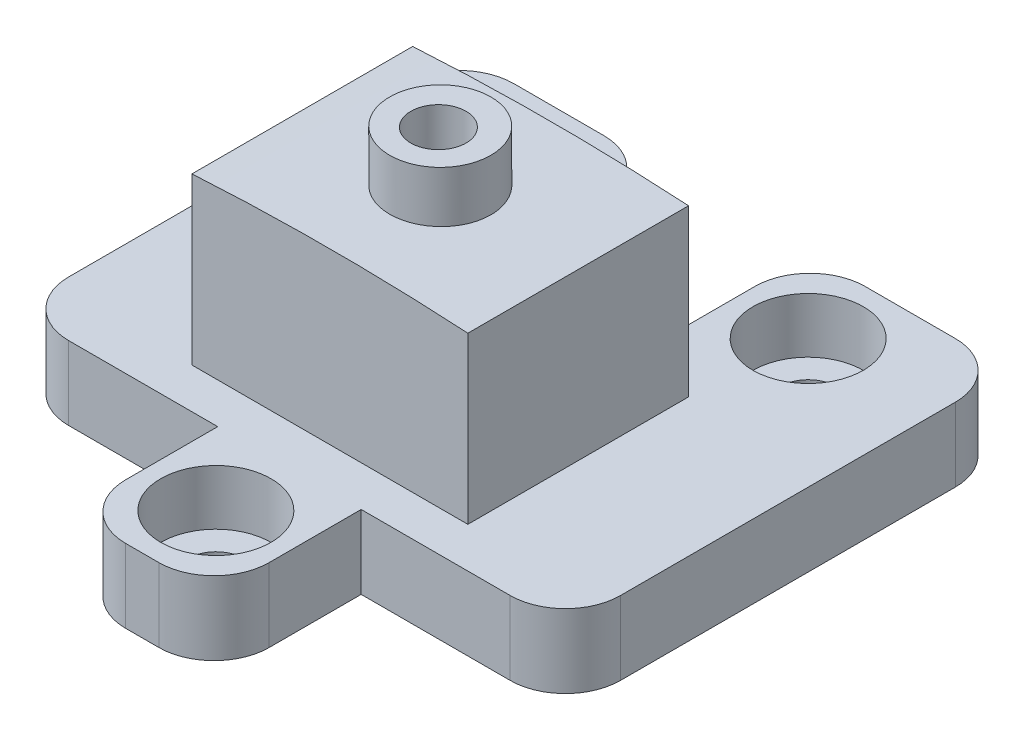
from build123d import *

# Parameters (mm, degrees)
EXTRUDE_1_DEPTH           = 4
SKETCH_2_R                = 1.5
CUT_EXTRUDE_2_DEPTH       = 23.365375025
SKETCH_3_R                = 3
CUT_EXTRUDE_3_DEPTH       = 3
FILLET_1_R                = 3
SKETCH_4_W                = 15
SKETCH_4_H                = 12
EXTRUDE_2_DEPTH           = 10
CUT_EXTRUDE_7_DEPTH       = 31.229786635
SKETCH_9_R                = 2.75
EXTRUDE_3_DEPTH           = 3
SKETCH_10_R               = 1.5
CUT_EXTRUDE_8_DEPTH       = 28.20680062
CUT_EXTRUDE_9_REACH       = 29.207
CUT_EXTRUDE_9_END_RADIUS  = 122
CUT_EXTRUDE_13_REACH      = 29.207
CUT_EXTRUDE_13_END_RADIUS = 119
SKETCH_12_W               = 8
SKETCH_12_H               = 6


with BuildPart() as part:
    # 草图1 → 凸台-拉伸1 (new body)
    with BuildSketch(Plane(origin=(0, 0, 0), x_dir=(1, 0, 0), z_dir=(0, 1, 0))):
        Polygon((-15, 16.1), (-4.1, 16.1), (-4.1, 8.1), (4.1, 8.1), (4.1, 16.1), (15, 16.1), (15, -8.1), (3.9, -8.1), (3.9, -16.1), (-3.9, -16.1), (-3.9, -8.1), (-15, -8.1), align=None)
    extrude(amount=EXTRUDE_1_DEPTH)

    # 草图2 → 切除-拉伸2 (cut, through all)
    with BuildSketch(Plane(origin=(0, 0, 0), x_dir=(1, 0, 0), z_dir=(0, 1, 0))):
        with Locations(Location((-8, 12.1, 0), (0, 0, 270))):
            Circle(SKETCH_2_R)
        with Locations(Location((8, 12.1, 0), (0, 0, 270))):
            Circle(SKETCH_2_R)
        with Locations(Location((0, -12.1, 0), (0, 0, 270))):
            Circle(SKETCH_2_R)
    extrude(amount=CUT_EXTRUDE_2_DEPTH, mode=Mode.SUBTRACT)

    # 草图3 → 切除-拉伸3 (cut)
    with BuildSketch(Plane(origin=(0, 4, 0), x_dir=(1, 0, 0), z_dir=(0, 1, 0))):
        with Locations(Location((-8, 12.1, 0), (0, 0, 270))):
            Circle(SKETCH_3_R)
        with Locations(Location((8, 12.1, 0), (0, 0, 270))):
            Circle(SKETCH_3_R)
        with Locations(Location((0, -12.1, 0), (0, 0, 270))):
            Circle(SKETCH_3_R)
    extrude(amount=-CUT_EXTRUDE_3_DEPTH, mode=Mode.SUBTRACT)

    # 圆角1
    fillet_1_edges = [part.edges().sort_by_distance(p)[0] for p in [
        (-15, 2, -16.1),
        (-4.1, 2, -16.1),
        (4.1, 2, -16.1),
        (15, 2, -16.1),
        (15, 2, 8.1),
        (3.9, 2, 16.1),
        (-3.9, 2, 16.1),
        (-15, 2, 8.1),
    ]]
    fillet(fillet_1_edges, radius=FILLET_1_R)

    # 草图4 → 凸台-拉伸2 (add)
    with BuildSketch(Plane(origin=(0, 4, 0), x_dir=(1, 0, 0), z_dir=(0, 1, 0))):
        with Locations((0, 0.1)):
            Rectangle(SKETCH_4_W, SKETCH_4_H)
    extrude(amount=EXTRUDE_2_DEPTH)

    # 草图8 → 切除-拉伸7 (cut, through all)
    with BuildSketch(Plane(origin=(0, 0, -6.1), x_dir=(-1, 0, 0), z_dir=(0, 0, -1))):
        with BuildLine():
            Line((-7.5, 13), (-7.5, 14))
            Line((-7.5, 14), (7.5, 14))
            Line((7.5, 14), (7.5, 13))
            ThreePointArc((7.5, 13), (0, 13.225202865), (-7.5, 13))
        make_face()
    extrude(amount=-CUT_EXTRUDE_7_DEPTH, mode=Mode.SUBTRACT)

    # 草图9 → 凸台-拉伸3 (add)
    with BuildSketch(Plane(origin=(0, 13, 0), x_dir=(-1, 0, 0), z_dir=(0, -1, 0))):
        with Locations(Location((0, 0.1, 0), (0, 0, 180))):
            Circle(SKETCH_9_R)
    extrude(amount=-EXTRUDE_3_DEPTH)

    # 草图10 → 切除-拉伸8 (cut, through all)
    with BuildSketch(Plane(origin=(0, 16, 0), x_dir=(1, 0, 0), z_dir=(0, 1, 0))):
        with Locations(Location((0, 0, 0), (0, 0, 180))):
            Circle(SKETCH_10_R)
    extrude(amount=-CUT_EXTRUDE_8_DEPTH, mode=Mode.SUBTRACT)

    # 切除-拉伸9: up to this cylinder (the profile starts inside it)
    cut_extrude_9_end = Plane(origin=(0, -111.774797135, 0), z_dir=(0, 0, -1)) * Cylinder(CUT_EXTRUDE_9_END_RADIUS, 303.414, mode=Mode.PRIVATE)
    # 草图11 → 切除-拉伸9 (cut, up to the surface)
    with BuildSketch(Plane.XZ, mode=Mode.PRIVATE) as cut_extrude_9_sk1:
        Polygon((3.175426481, 0), (1.58771324, 2.75), (-1.58771324, 2.75), (-3.175426481, 0), (-1.58771324, -2.75), (1.58771324, -2.75), align=None)
    cut_extrude_9_tool1 = extrude(cut_extrude_9_sk1.sketch, amount=-CUT_EXTRUDE_9_REACH, mode=Mode.PRIVATE) & cut_extrude_9_end
    add(cut_extrude_9_tool1.solids().sort_by_distance((0, 0, 0))[0], mode=Mode.SUBTRACT)

    # 切除-拉伸13: up to this cylinder (the profile starts inside it)
    cut_extrude_13_end = Plane(origin=(0, -111.774797135, 0), z_dir=(0, 0, -1)) * Cylinder(CUT_EXTRUDE_13_END_RADIUS, 297.414, mode=Mode.PRIVATE)
    # 草图12 → 切除-拉伸13 (cut, up to the surface)
    with BuildSketch(Plane.XZ, mode=Mode.PRIVATE) as cut_extrude_13_sk1:
        Rectangle(SKETCH_12_W, SKETCH_12_H)
    cut_extrude_13_tool1 = extrude(cut_extrude_13_sk1.sketch, amount=-CUT_EXTRUDE_13_REACH, mode=Mode.PRIVATE) & cut_extrude_13_end
    add(cut_extrude_13_tool1.solids().sort_by_distance((0, 0, 0))[0], mode=Mode.SUBTRACT)


solid = part.part
